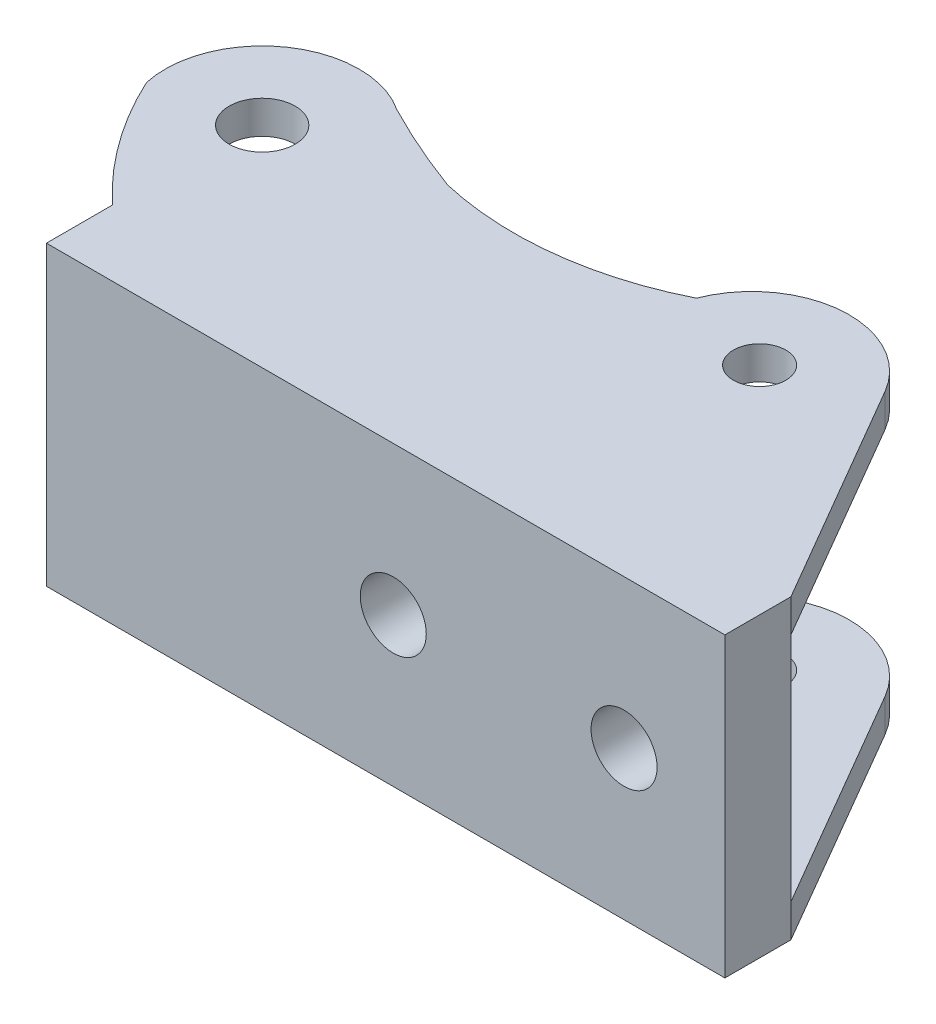
from build123d import *

# Parameters (mm, degrees)
SKETCH2_W           = 102.74136237
SKETCH2_H           = 45
SKETCH2_R           = 5
BOSS_EXTRUDE1_DEPTH = 10
SKETCH3_R           = 5
SKETCH3_R_2         = 3.96875
BOSS_EXTRUDE2_DEPTH = 5


with BuildPart() as part:
    # Sketch2 → Boss-Extrude1 (new body)
    with BuildSketch(Plane.XY):
        with Locations((-18.629318815, 0)):
            Rectangle(SKETCH2_W, SKETCH2_H)
        with Locations((17.475, 0)):
            Circle(SKETCH2_R, mode=Mode.SUBTRACT)
        with Locations((-17.475, 0)):
            Circle(SKETCH2_R, mode=Mode.SUBTRACT)
    extrude(amount=BOSS_EXTRUDE1_DEPTH)

    # Sketch3 → Boss-Extrude2 (add)
    with BuildSketch(Plane(origin=(0, 22.5, 0), x_dir=(1, 0, 0), z_dir=(0, 1, 0))):
        with BuildLine():
            Line((32.74136237, -10), (32.74136237, 0))
            Line((32.74136237, 0), (12.941825805, 34.051297768))
            ThreePointArc((12.941825805, 34.051297768), (-0.958840285, 41.349241447), (-13.571539602, 32))
            ThreePointArc((-13.571539602, 32), (-30.051797166, 27.060729478), (-47.230652005, 28))
            ThreePointArc((-47.230652005, 28), (-54.208421011, 30.810382158), (-60.996938829, 34.051297768))
            ThreePointArc((-60.996938829, 34.051297768), (-77.438081848, 33.940854804), (-83.493041421, 18.654885879))
            ThreePointArc((-83.493041421, 18.654885879), (-77.649691032, 8.674181664), (-70, 0))
            Line((-70, 0), (-70, -10))
            Line((-70, -10), (32.74136237, -10))
        make_face()
        with Locations(Location((-69.135650368, 21.809953676, 0), (0, 0, 270))):
            Circle(SKETCH3_R, mode=Mode.SUBTRACT)
        with Locations(Location((0, 28, 0), (0, 0, 270))):
            Circle(SKETCH3_R_2, mode=Mode.SUBTRACT)
    boss_extrude2 = extrude(amount=-BOSS_EXTRUDE2_DEPTH)

    # Mirror1: Boss-Extrude2 across plane
    add(boss_extrude2.mirror(Plane.ZX))


solid = part.part
